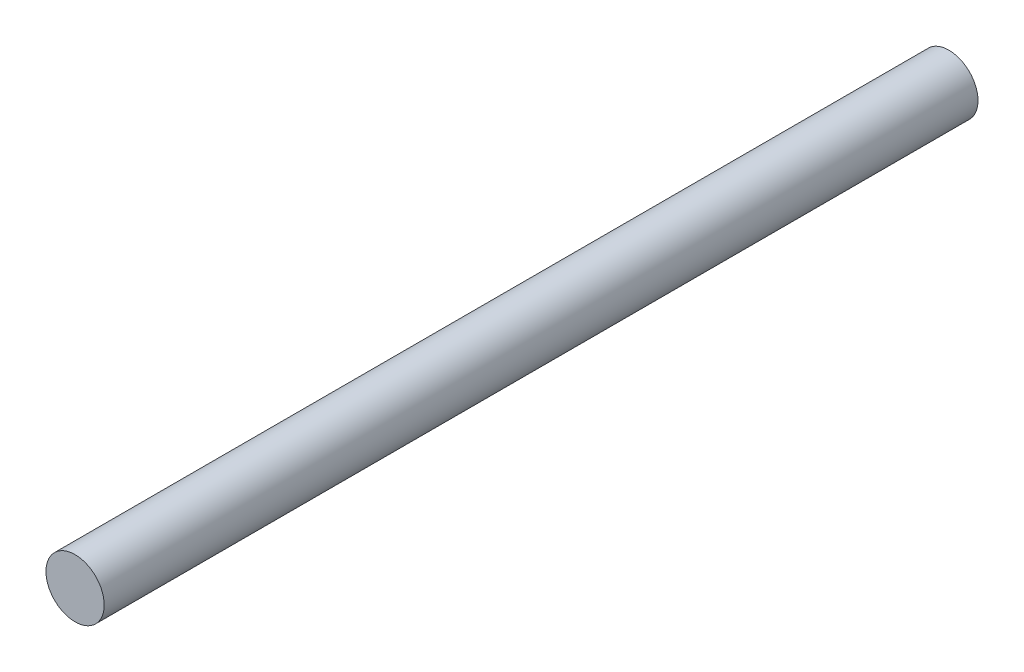
from build123d import *

# Parameters (mm, degrees)
SKETCH1_R           = 0.6
BOSS_EXTRUDE1_DEPTH = 18


with BuildPart() as part:
    # Sketch1 → Boss-Extrude1 (new body)
    with BuildSketch(Plane.XY):
        with Locations((-37.239062554, -4.1)):
            Circle(SKETCH1_R)
    extrude(amount=-BOSS_EXTRUDE1_DEPTH)


solid = part.part
